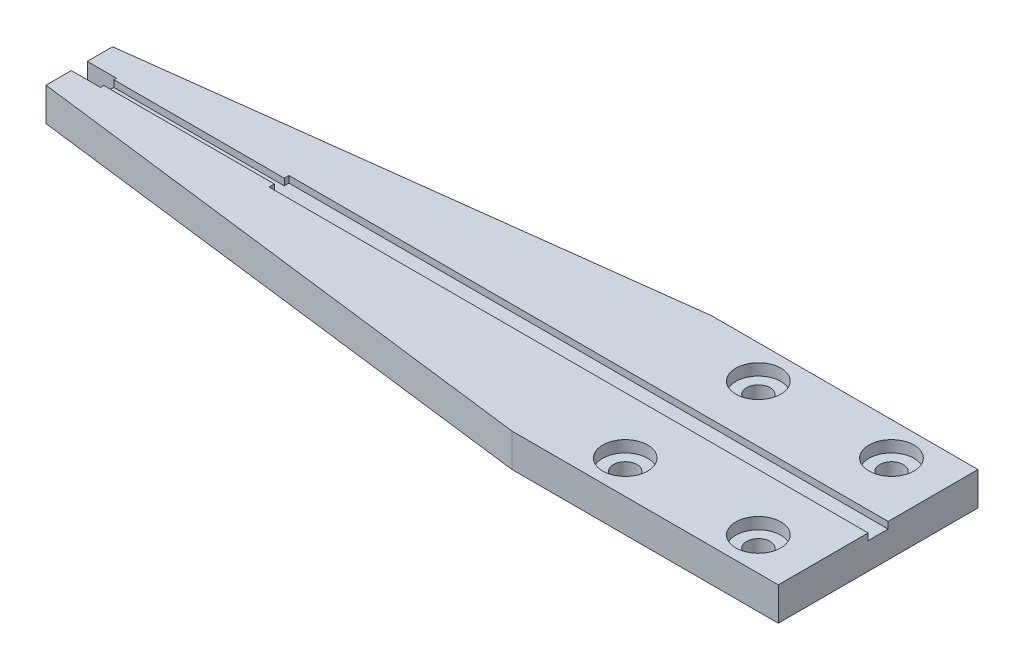
from build123d import *

# Parameters (mm, degrees)
SKETCH2_W                       = 38.1
SKETCH2_H                       = 6.35
BOSS_EXTRUDE1_DEPTH             = 152.4
CBORE_FOR_M4_SBHCS1_D           = 4.5
CBORE_FOR_M4_SBHCS1_CBORE_D     = 8.6
CBORE_FOR_M4_SBHCS1_CBORE_DEPTH = 2.2
SKETCH9_W                       = 3.048
SKETCH9_H                       = 3.048
CUT_EXTRUDE1_DEPTH              = 5.588
SKETCH12_W                      = 114.3
SKETCH12_H                      = 3.81
CUT_EXTRUDE2_DEPTH              = 1.27
SKETCH13_W                      = 32.512
SKETCH13_H                      = 1.905
CUT_EXTRUDE3_DEPTH              = 1.27
CUT_EXTRUDE4_DEPTH              = 6.35
CUT_EXTRUDE5_DEPTH              = 6.35


with BuildPart() as part:
    # Sketch2 → Boss-Extrude1 (new body)
    with BuildSketch(Plane(origin=(0, 0, 0), x_dir=(0, 0, -1), z_dir=(1, 0, 0))):
        Rectangle(SKETCH2_W, SKETCH2_H)
    extrude(amount=BOSS_EXTRUDE1_DEPTH)

    # CBORE for M4 SBHCS1 (through all)
    with Locations(Plane(origin=(0, 3.175, 0), x_dir=(1, 0, 0), z_dir=(0, 1, 0))):
        with Locations((142.247626007, -12.7), (142.247626007, 12.7), (116.847626007, 12.7), (116.847626007, -12.7)):
            CounterBoreHole(CBORE_FOR_M4_SBHCS1_D / 2, CBORE_FOR_M4_SBHCS1_CBORE_D / 2, CBORE_FOR_M4_SBHCS1_CBORE_DEPTH)

    # Sketch9 → Cut-Extrude1 (cut)
    with BuildSketch(Plane.ZY):
        with Locations((0, 1.651)):
            Rectangle(SKETCH9_W, SKETCH9_H)
    extrude(amount=-CUT_EXTRUDE1_DEPTH, mode=Mode.SUBTRACT)

    # Sketch12 → Cut-Extrude2 (cut)
    with BuildSketch(Plane(origin=(0, 3.175, 0), x_dir=(1, 0, 0), z_dir=(0, 1, 0))):
        with Locations((95.25, 0)):
            Rectangle(SKETCH12_W, SKETCH12_H)
    extrude(amount=-CUT_EXTRUDE2_DEPTH, mode=Mode.SUBTRACT)

    # Sketch13 → Cut-Extrude3 (cut)
    with BuildSketch(Plane(origin=(0, 3.175, 0), x_dir=(1, 0, 0), z_dir=(0, 1, 0))):
        with Locations((21.844, 0.0635)):
            Rectangle(SKETCH13_W, SKETCH13_H)
    extrude(amount=-CUT_EXTRUDE3_DEPTH, mode=Mode.SUBTRACT)

    # Sketch14 → Cut-Extrude4 (cut)
    with BuildSketch(Plane(origin=(0, 3.175, 0), x_dir=(1, 0, 0), z_dir=(0, 1, 0))):
        Polygon((0, 6.35), (0, 19.05), (101.6, 19.05), align=None)
    extrude(amount=-CUT_EXTRUDE4_DEPTH, mode=Mode.SUBTRACT)

    # Sketch15 → Cut-Extrude5 (cut)
    with BuildSketch(Plane(origin=(0, 3.175, 0), x_dir=(1, 0, 0), z_dir=(0, 1, 0))):
        Polygon((0, -6.35), (101.6, -19.05), (0, -19.05), align=None)
    extrude(amount=-CUT_EXTRUDE5_DEPTH, mode=Mode.SUBTRACT)


solid = part.part
